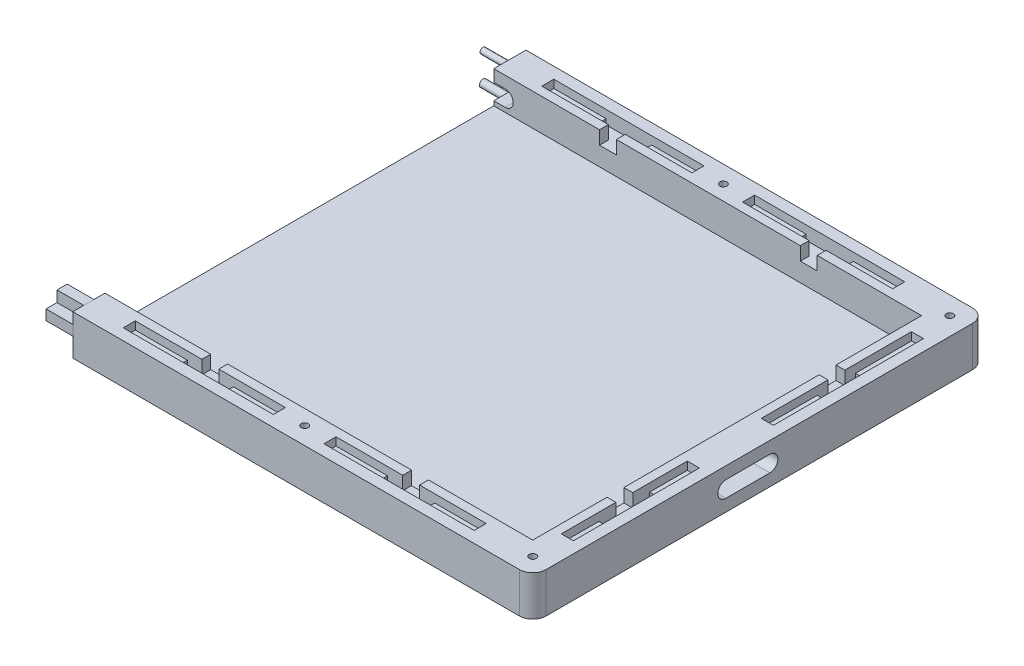
from build123d import *

# Parameters (mm, degrees)
SKETCH1_W           = 159.54
SKETCH1_H           = 145
BOSS_EXTRUDE1_DEPTH = 3
BOSS_EXTRUDE2_DEPTH = 15
CUT_EXTRUDE1_DEPTH  = 3
CUT_EXTRUDE2_DEPTH  = 2
CUT_EXTRUDE3_DEPTH  = 12
CUT_EXTRUDE4_DEPTH  = 12
SKETCH8_R           = 1.1
SKETCH8_R_2         = 1.35
BOSS_EXTRUDE3_DEPTH = 10
BOSS_EXTRUDE5_DEPTH = 10
FILLET3_R           = 5
FILLET4_R           = 5
SKETCH10_R          = 1.325
CUT_EXTRUDE5_DEPTH  = 17
SKETCH12_R          = 3
CUT_EXTRUDE6_DEPTH  = 5
SKETCH13_R          = 6.25
CUT_EXTRUDE7_DEPTH  = 1


with BuildPart() as part:
    # Sketch1 → Boss-Extrude1 (new body)
    with BuildSketch(Plane(origin=(0, 0, 0), x_dir=(1, 0, 0), z_dir=(0, 1, 0))):
        with Locations((79.77, 0)):
            Rectangle(SKETCH1_W, SKETCH1_H)
    extrude(amount=BOSS_EXTRUDE1_DEPTH)

    # Sketch3 → Boss-Extrude2 (add)
    with BuildSketch(Plane(origin=(0, 0, 0), x_dir=(1, 0, 0), z_dir=(0, 1, 0))):
        Polygon((0, 72.5), (0, 84.5), (171.54, 84.5), (171.54, -84.5), (0, -84.5), (0, -72.5), (159.54, -72.5), (159.54, 72.5), align=None)
    extrude(amount=BOSS_EXTRUDE2_DEPTH)

    # Sketch4 → Cut-Extrude1 (cut)
    with BuildSketch(Plane(origin=(0, 15, 0), x_dir=(1, 0, 0), z_dir=(0, 1, 0))):
        Polygon((45.75, 75.8), (45.75, 72.5), (39.45, 72.5), (39.45, 75.8), (14.6, 75.8), (14.6, 80.3), (70.6, 80.3), (70.6, 75.8), align=None)
        Polygon((120.64, 75.8), (120.64, 72.5), (114.34, 72.5), (114.34, 75.8), (89.49, 75.8), (89.49, 80.3), (145.49, 80.3), (145.49, 75.8), align=None)
        Polygon((145.49, -75.8), (120.64, -75.8), (120.64, -72.5), (114.34, -72.5), (114.34, -75.8), (89.49, -75.8), (89.49, -80.3), (145.49, -80.3), align=None)
        Polygon((70.6, -75.8), (45.75, -75.8), (45.75, -72.5), (39.45, -72.5), (39.45, -75.8), (14.6, -75.8), (14.6, -80.3), (70.6, -80.3), align=None)
        Polygon((159.54, -38.5), (162.84, -38.5), (162.84, -18.15), (167.34, -18.15), (167.34, -65.15), (162.84, -65.15), (162.84, -44.8), (159.54, -44.8), align=None)
        Polygon((159.54, 40.6), (162.84, 40.6), (162.84, 65.45), (167.34, 65.45), (167.34, 9.45), (162.84, 9.45), (162.84, 34.3), (159.54, 34.3), align=None)
    extrude(amount=-CUT_EXTRUDE1_DEPTH, mode=Mode.SUBTRACT)

    # Sketch5 → Cut-Extrude2 (cut)
    with BuildSketch(Plane(origin=(0, 12, 0), x_dir=(1, 0, 0), z_dir=(0, 1, 0))):
        Polygon((39.45, -72.5), (39.45, -75.8), (33.99806762, -75.8), (33.99806762, -80.3), (51.20193238, -80.3), (51.20193238, -75.8), (45.75, -75.8), (45.75, -72.5), align=None)
        Polygon((114.34, -75.8), (108.704865037, -75.8), (108.704865037, -80.3), (126.275134963, -80.3), (126.275134963, -75.8), (120.64, -75.8), (120.64, -72.5), (114.34, -72.5), align=None)
        Polygon((120.64, 72.5), (114.34, 72.5), (114.34, 75.8), (108.704865037, 75.8), (108.704865037, 80.3), (126.308635122, 80.3), (126.308635122, 75.8), (120.64, 75.8), align=None)
        Polygon((45.75, 72.5), (39.45, 72.5), (39.45, 75.8), (34.110302497, 75.8), (34.110302497, 80.3), (51.089697503, 80.3), (51.089697503, 75.8), (45.75, 75.8), align=None)
        Polygon((159.54, -44.8), (159.54, -38.5), (162.84, -38.5), (162.84, -32.205861204), (167.34, -32.205861204), (167.34, -51.094138796), (162.84, -51.094138796), (162.84, -44.8), align=None)
        Polygon((159.54, 40.6), (162.84, 40.6), (162.84, 44.579740263), (167.34, 44.579740263), (167.34, 30.320259737), (162.84, 30.320259737), (162.84, 34.3), (159.54, 34.3), align=None)
    extrude(amount=-CUT_EXTRUDE2_DEPTH, mode=Mode.SUBTRACT)

    # Sketch6 → Cut-Extrude3 (cut)
    with BuildSketch(Plane(origin=(171.54, 0, 0), x_dir=(0, 0, -1), z_dir=(1, 0, 0))):
        with BuildLine():
            Line((-12.45, 10.5), (3.93, 10.5))
            ThreePointArc((3.93, 10.5), (6.93, 7.5), (3.93, 4.5))
            Line((3.93, 4.5), (-12.45, 4.5))
            ThreePointArc((-12.45, 4.5), (-15.45, 7.5), (-12.45, 10.5))
        make_face()
    extrude(amount=-CUT_EXTRUDE3_DEPTH, mode=Mode.SUBTRACT)

    # Sketch7 → Cut-Extrude4 (cut)
    with BuildSketch(Plane(origin=(0, 0, -84.5), x_dir=(-1, 0, 0), z_dir=(0, 0, -1))):
        with BuildLine():
            Line((-4.24, 10.6343), (12.14, 10.6343))
            ThreePointArc((12.14, 10.6343), (15.14, 7.6343), (12.14, 4.6343))
            Line((12.14, 4.6343), (-4.24, 4.6343))
            ThreePointArc((-4.24, 4.6343), (-7.24, 7.6343), (-4.24, 10.6343))
        make_face()
    extrude(amount=-CUT_EXTRUDE4_DEPTH, mode=Mode.SUBTRACT)

    # Sketch8 → Boss-Extrude3 (add)
    with BuildSketch(Plane.ZY):
        with Locations(Location((-78.5, 12.81715, 0), (0, 0, 180))):
            Circle(SKETCH8_R)
        with Locations(Location((-78.5, 2.328843142, 0), (0, 0, 180))):
            Circle(SKETCH8_R_2)
    extrude(amount=BOSS_EXTRUDE3_DEPTH)

    # Sketch9 → Boss-Extrude5 (add)
    with BuildSketch(Plane.ZY):
        Polygon((76.6, 14.98895691), (80.4, 14.98895691), (80.4, 10.9), (84.489160504, 10.9), (84.489160504, 7.1), (80.4, 7.1), (80.4, 3.01104309), (76.6, 3.01104309), (76.6, 7.100000004), (72.511375857, 7.100000004), (72.511117499, 10.899999996), (76.6, 10.899999996), align=None)
    extrude(amount=BOSS_EXTRUDE5_DEPTH)

    # Fillet3
    fillet3_edges = [part.edges().sort_by_distance(p)[0] for p in [
        (171.54, 7.5, 84.5),
    ]]
    fillet(fillet3_edges, radius=FILLET3_R)

    # Fillet4
    fillet4_edges = [part.edges().sort_by_distance(p)[0] for p in [
        (171.54, 7.5, -84.5),
    ]]
    fillet(fillet4_edges, radius=FILLET4_R)

    # Sketch10 → Cut-Extrude5 (cut)
    with BuildSketch(Plane.XZ):
        with Locations(Location((80.0525, 78.05, 0), (0, 0, 270))):
            Circle(SKETCH10_R)
        with Locations(Location((164.807766953, 77.767766953, 0), (0, 0, 270))):
            Circle(SKETCH10_R)
        with Locations(Location((164.807766953, -77.767766953, 0), (0, 0, 270))):
            Circle(SKETCH10_R)
        with Locations(Location((80.0525, -78.05, 0), (0, 0, 270))):
            Circle(SKETCH10_R)
    extrude(amount=-CUT_EXTRUDE5_DEPTH, mode=Mode.SUBTRACT)

    # Sketch12 → Cut-Extrude6 (cut)
    with BuildSketch(Plane(origin=(0, 0, 0), x_dir=(-1, 0, 0), z_dir=(0, -1, 0))):
        with Locations(Location((-80.0525, -78.05, 0), (0, 0, 90))):
            Circle(SKETCH12_R)
        with Locations(Location((-164.807766953, -77.767766953, 0), (0, 0, 90))):
            Circle(SKETCH12_R)
        with Locations(Location((-164.807766953, 77.767766953, 0), (0, 0, 90))):
            Circle(SKETCH12_R)
        with Locations(Location((-80.0525, 78.05, 0), (0, 0, 90))):
            Circle(SKETCH12_R)
    extrude(amount=-CUT_EXTRUDE6_DEPTH, mode=Mode.SUBTRACT)

    # Sketch13 → Cut-Extrude7 (cut)
    with BuildSketch(Plane.XZ):
        with Locations(Location((151.54, 64.5, 0), (0, 0, 270))):
            Circle(SKETCH13_R)
        with Locations(Location((151.54, -64.5, 0), (0, 0, 270))):
            Circle(SKETCH13_R)
    extrude(amount=-CUT_EXTRUDE7_DEPTH, mode=Mode.SUBTRACT)


solid = part.part
